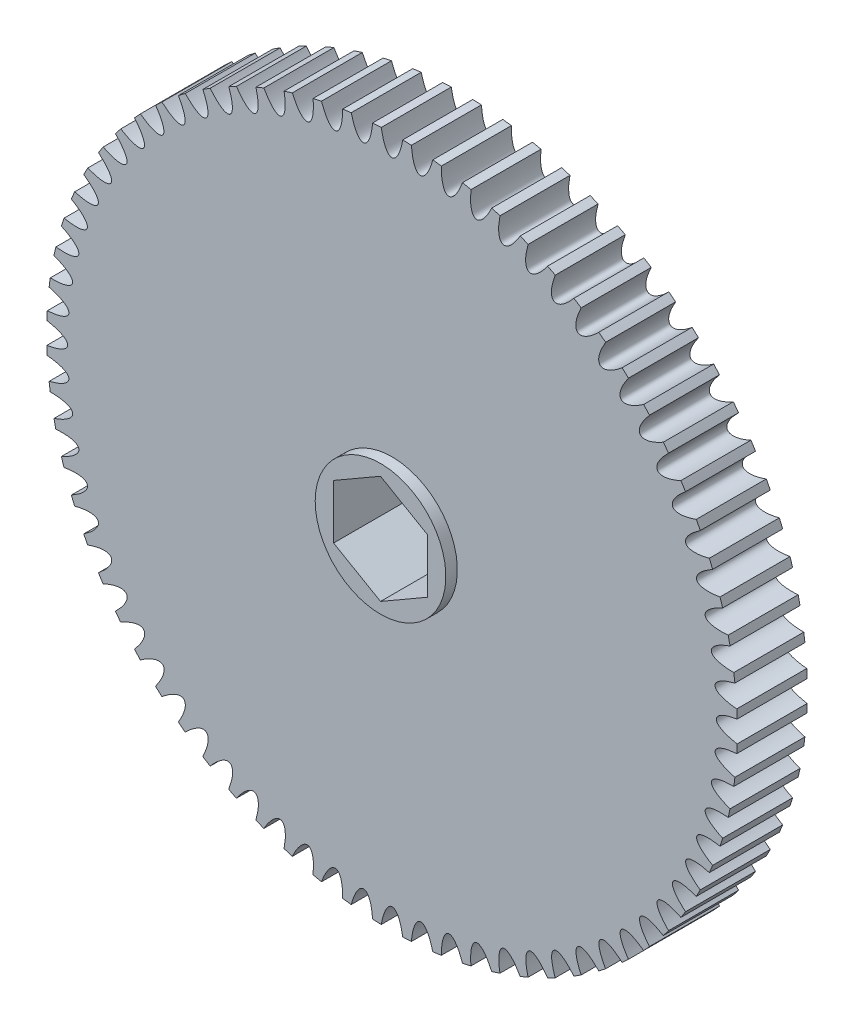
from build123d import *

# Parameters (mm, degrees)
BOSS_EXTRUDE1_DEPTH = 9.525
SKETCH2_R           = 8.89
BOSS_EXTRUDE2_DEPTH = 1.5621
BOSS_EXTRUDE3_START = 1.5621
SKETCH3_R           = 8.89
BOSS_EXTRUDE3_DEPTH = 1.5621
CUT_EXTRUDE1_DEPTH  = 68.615408008


with BuildPart() as part:
    # Sketch1 → Boss-Extrude1 (new body)
    with BuildSketch(Plane(origin=(0, 0, -4.7625), x_dir=(-1, 0, 0), z_dir=(0, 0, -1))):
        with BuildLine():
            ThreePointArc((-46.91598824, 2.63631324), (-46.945275932, 2.049675012), (-46.967228579, 1.462716529))
            add(Edge.make_bspline(
                [(-46.967228579, -1.462716529), (-38.209901537, 0.069174931), (-46.967228579, 1.462716529)],
                knots=[2.067305038, 2.067305038, 2.067305038, 4.210539871, 4.210539871, 4.210539871], degree=2, weights=[1, 0.478704803, 1]))
            ThreePointArc((-46.967228579, -1.462716529), (-46.945275932, -2.049675012), (-46.91598824, -2.63631324))
            add(Edge.make_bspline(
                [(-46.661019949, -5.550614143), (-38.070530317, -3.261300649), (-46.91598824, -2.63631324)],
                knots=[2.067305038, 2.067305038, 2.067305038, 4.210539871, 4.210539871, 4.210539871], degree=2, weights=[1, 0.478704803, 1]))
            ThreePointArc((-46.661019949, -5.550614143), (-46.587994036, -6.133425772), (-46.507688901, -6.715279074))
            add(Edge.make_bspline(
                [(-45.999692782, -9.596268231), (-37.641419376, -6.566955762), (-46.507688901, -6.715279074)],
                knots=[2.067305038, 2.067305038, 2.067305038, 4.210539871, 4.210539871, 4.210539871], degree=2, weights=[1, 0.478704803, 1]))
            ThreePointArc((-45.999692782, -9.596268231), (-45.876149375, -10.170497459), (-45.745437969, -10.743137579))
            add(Edge.make_bspline(
                [(-44.988280178, -13.568888924), (-36.925834504, -9.822632377), (-45.745437969, -10.743137579)],
                knots=[2.067305038, 2.067305038, 2.067305038, 4.210539871, 4.210539871, 4.210539871], degree=2, weights=[1, 0.478704803, 1]))
            ThreePointArc((-44.988280178, -13.568888924), (-44.815159516, -14.130165519), (-44.635036631, -14.689234321))
            add(Edge.make_bspline(
                [(-43.634479597, -17.438242179), (-35.929221735, -13.003552828), (-44.635036631, -14.689234321)],
                knots=[2.067305038, 2.067305038, 2.067305038, 4.210539871, 4.210539871, 4.210539871], degree=2, weights=[1, 0.478704803, 1]))
            ThreePointArc((-43.634479597, -17.438242179), (-43.413099233, -17.982294487), (-43.184935713, -18.52353712))
            add(Edge.make_bspline(
                [(-41.948594279, -21.174879882), (-34.659165893, -16.08550839), (-43.184935713, -18.52353712)],
                knots=[2.067305038, 2.067305038, 2.067305038, 4.210539871, 4.210539871, 4.210539871], degree=2, weights=[1, 0.478704803, 1]))
            ThreePointArc((-41.948594279, -21.174879882), (-41.680639051, -21.697567336), (-41.406171359, -22.216864616))
            add(Edge.make_bspline(
                [(-39.94345483, -24.750363962), (-33.125332872, -19.045043521), (-41.406171359, -22.216864616)],
                knots=[2.067305038, 2.067305038, 2.067305038, 4.210539871, 4.210539871, 4.210539871], degree=2, weights=[1, 0.478704803, 1]))
            ThreePointArc((-39.94345483, -24.750363962), (-39.630964039, -25.247708596), (-39.312281039, -25.741108358))
            add(Edge.make_bspline(
                [(-37.63432157, -28.137482829), (-31.339396067, -21.859634371), (-39.312281039, -25.741108358)],
                knots=[2.067305038, 2.067305038, 2.067305038, 4.210539871, 4.210539871, 4.210539871], degree=2, weights=[1, 0.478704803, 1]))
            ThreePointArc((-37.63432157, -28.137482829), (-37.27967346, -28.605699549), (-36.919200523, -29.069446722))
            add(Edge.make_bspline(
                [(-35.0387684, -31.310458461), (-29.314947533, -24.507860203), (-36.919200523, -29.069446722)],
                knots=[2.067305038, 2.067305038, 2.067305038, 4.210539871, 4.210539871, 4.210539871], degree=2, weights=[1, 0.478704803, 1]))
            ThreePointArc((-35.0387684, -31.310458461), (-34.644662057, -31.745983856), (-34.245142598, -32.176549045))
            add(Edge.make_bspline(
                [(-32.176549045, -34.245142598), (-27.067394547, -26.969566421), (-34.245142598, -32.176549045)],
                knots=[5.208897692, 5.208897692, 5.208897692, 7.352132525, 7.352132525, 7.352132525], degree=2, weights=[1, 0.478704803, 1]))
            ThreePointArc((-32.176549045, -34.245142598), (-31.745983856, -34.644662057), (-31.310458461, -35.0387684))
            add(Edge.make_bspline(
                [(-29.069446722, -36.919200523), (-24.613842347, -29.226017956), (-31.310458461, -35.0387684)],
                knots=[2.067305038, 2.067305038, 2.067305038, 4.210539871, 4.210539871, 4.210539871], degree=2, weights=[1, 0.478704803, 1]))
            ThreePointArc((-29.069446722, -36.919200523), (-28.605699549, -37.27967346), (-28.137482829, -37.63432157))
            add(Edge.make_bspline(
                [(-25.741108358, -39.312281039), (-21.972963943, -31.260041845), (-28.137482829, -37.63432157)],
                knots=[2.067305038, 2.067305038, 2.067305038, 4.210539871, 4.210539871, 4.210539871], degree=2, weights=[1, 0.478704803, 1]))
            ThreePointArc((-25.741108358, -39.312281039), (-25.247708596, -39.630964039), (-24.750363962, -39.94345483))
            add(Edge.make_bspline(
                [(-22.216864616, -41.406171359), (-19.164858016, -33.056157941), (-24.750363962, -39.94345483)],
                knots=[5.208897692, 5.208897692, 5.208897692, 7.352132525, 7.352132525, 7.352132525], degree=2, weights=[1, 0.478704803, 1]))
            ThreePointArc((-22.216864616, -41.406171359), (-21.697567336, -41.680639051), (-21.174879882, -41.948594279))
            add(Edge.make_bspline(
                [(-18.52353712, -43.184935713), (-16.210895948, -34.600696716), (-21.174879882, -41.948594279)],
                knots=[5.208897692, 5.208897692, 5.208897692, 7.352132524, 7.352132524, 7.352132524], degree=2, weights=[1, 0.478704803, 1]))
            ThreePointArc((-18.52353712, -43.184935713), (-17.982294487, -43.413099233), (-17.438242179, -43.634479597))
            add(Edge.make_bspline(
                [(-14.689234321, -44.635036631), (-13.133559172, -35.881903296), (-17.438242179, -43.634479597)],
                knots=[5.208897692, 5.208897692, 5.208897692, 7.352132524, 7.352132524, 7.352132524], degree=2, weights=[1, 0.478704803, 1]))
            ThreePointArc((-14.689234321, -44.635036631), (-14.130165519, -44.815159516), (-13.568888924, -44.988280178))
            add(Edge.make_bspline(
                [(-10.743137579, -45.745437969), (-9.956268082, -36.890026925), (-13.568888924, -44.988280178)],
                knots=[5.208897692, 5.208897692, 5.208897692, 7.352132524, 7.352132524, 7.352132524], degree=2, weights=[1, 0.478704803, 1]))
            ThreePointArc((-10.743137579, -45.745437969), (-10.170497459, -45.876149375), (-9.596268231, -45.999692782))
            add(Edge.make_bspline(
                [(-6.715279074, -46.507688901), (-6.703203779, -37.617395174), (-9.596268231, -45.999692782)],
                knots=[5.208897692, 5.208897692, 5.208897692, 7.352132524, 7.352132524, 7.352132524], degree=2, weights=[1, 0.478704803, 1]))
            ThreePointArc((-6.715279074, -46.507688901), (-6.133425772, -46.587994036), (-5.550614143, -46.661019949))
            add(Edge.make_bspline(
                [(-2.63631324, -46.91598824), (-3.399124048, -38.058472334), (-5.550614143, -46.661019949)],
                knots=[5.208897692, 5.208897692, 5.208897692, 7.352132524, 7.352132524, 7.352132524], degree=2, weights=[1, 0.478704803, 1]))
            ThreePointArc((-2.63631324, -46.91598824), (-2.049675012, -46.945275932), (-1.462716529, -46.967228579))
            add(Edge.make_bspline(
                [(1.462716529, -46.967228579), (-0.069174931, -38.209901537), (-1.462716529, -46.967228579)],
                knots=[5.208897692, 5.208897692, 5.208897692, 7.352132524, 7.352132524, 7.352132524], degree=2, weights=[1, 0.478704803, 1]))
            ThreePointArc((1.462716529, -46.967228579), (2.049675012, -46.945275932), (2.63631324, -46.91598824))
            add(Edge.make_bspline(
                [(5.550614143, -46.661019949), (3.261300649, -38.070530317), (2.63631324, -46.91598824)],
                knots=[5.208897692, 5.208897692, 5.208897692, 7.352132525, 7.352132525, 7.352132525], degree=2, weights=[1, 0.478704803, 1]))
            ThreePointArc((5.550614143, -46.661019949), (6.133425772, -46.587994036), (6.715279074, -46.507688901))
            add(Edge.make_bspline(
                [(9.596268231, -45.999692782), (6.566955762, -37.641419376), (6.715279074, -46.507688901)],
                knots=[2.067305038, 2.067305038, 2.067305038, 4.210539871, 4.210539871, 4.210539871], degree=2, weights=[1, 0.478704803, 1]))
            ThreePointArc((9.596268231, -45.999692782), (10.170497459, -45.876149375), (10.743137579, -45.745437969))
            add(Edge.make_bspline(
                [(13.568888924, -44.988280178), (9.822632377, -36.925834504), (10.743137579, -45.745437969)],
                knots=[5.208897692, 5.208897692, 5.208897692, 7.352132525, 7.352132525, 7.352132525], degree=2, weights=[1, 0.478704803, 1]))
            ThreePointArc((13.568888924, -44.988280178), (14.130165519, -44.815159516), (14.689234321, -44.635036631))
            add(Edge.make_bspline(
                [(17.438242179, -43.634479597), (13.003552828, -35.929221735), (14.689234321, -44.635036631)],
                knots=[5.208897692, 5.208897692, 5.208897692, 7.352132524, 7.352132524, 7.352132524], degree=2, weights=[1, 0.478704803, 1]))
            ThreePointArc((17.438242179, -43.634479597), (17.982294487, -43.413099233), (18.52353712, -43.184935713))
            add(Edge.make_bspline(
                [(21.174879882, -41.948594279), (16.08550839, -34.659165894), (18.52353712, -43.184935713)],
                knots=[5.208897692, 5.208897692, 5.208897692, 7.352132525, 7.352132525, 7.352132525], degree=2, weights=[1, 0.478704803, 1]))
            ThreePointArc((21.174879882, -41.948594279), (21.697567336, -41.680639051), (22.216864616, -41.406171359))
            add(Edge.make_bspline(
                [(24.750363962, -39.94345483), (19.045043521, -33.125332873), (22.216864616, -41.406171359)],
                knots=[5.208897692, 5.208897692, 5.208897692, 7.352132524, 7.352132524, 7.352132524], degree=2, weights=[1, 0.478704803, 1]))
            ThreePointArc((24.750363962, -39.94345483), (25.247708596, -39.630964039), (25.741108358, -39.312281039))
            add(Edge.make_bspline(
                [(28.137482829, -37.63432157), (21.85963437, -31.339396066), (25.741108358, -39.312281039)],
                knots=[5.208897692, 5.208897692, 5.208897692, 7.352132525, 7.352132525, 7.352132525], degree=2, weights=[1, 0.478704803, 1]))
            ThreePointArc((28.137482829, -37.63432157), (28.605699549, -37.27967346), (29.069446722, -36.919200523))
            add(Edge.make_bspline(
                [(31.310458461, -35.0387684), (24.507860204, -29.314947533), (29.069446722, -36.919200523)],
                knots=[5.208897692, 5.208897692, 5.208897692, 7.352132524, 7.352132524, 7.352132524], degree=2, weights=[1, 0.478704803, 1]))
            ThreePointArc((31.310458461, -35.0387684), (31.745983856, -34.644662057), (32.176549045, -34.245142598))
            add(Edge.make_bspline(
                [(34.245142598, -32.176549045), (26.969566423, -27.067394549), (32.176549045, -34.245142598)],
                knots=[5.208897692, 5.208897692, 5.208897692, 7.352132524, 7.352132524, 7.352132524], degree=2, weights=[1, 0.478704803, 1]))
            ThreePointArc((34.245142598, -32.176549045), (34.644662057, -31.745983856), (35.0387684, -31.310458461))
            add(Edge.make_bspline(
                [(36.919200523, -29.069446722), (29.226017957, -24.613842347), (35.0387684, -31.310458461)],
                knots=[5.208897692, 5.208897692, 5.208897692, 7.352132524, 7.352132524, 7.352132524], degree=2, weights=[1, 0.478704803, 1]))
            ThreePointArc((36.919200523, -29.069446722), (37.27967346, -28.605699549), (37.63432157, -28.137482829))
            add(Edge.make_bspline(
                [(39.312281039, -25.741108358), (31.260041845, -21.972963943), (37.63432157, -28.137482829)],
                knots=[5.208897692, 5.208897692, 5.208897692, 7.352132525, 7.352132525, 7.352132525], degree=2, weights=[1, 0.478704803, 1]))
            ThreePointArc((39.312281039, -25.741108358), (39.630964039, -25.247708596), (39.94345483, -24.750363962))
            add(Edge.make_bspline(
                [(41.406171359, -22.216864616), (33.056157942, -19.164858016), (39.94345483, -24.750363962)],
                knots=[5.208897692, 5.208897692, 5.208897692, 7.352132524, 7.352132524, 7.352132524], degree=2, weights=[1, 0.478704803, 1]))
            ThreePointArc((41.406171359, -22.216864616), (41.680639051, -21.697567336), (41.948594279, -21.174879882))
            add(Edge.make_bspline(
                [(43.184935713, -18.52353712), (34.600696716, -16.210895948), (41.948594279, -21.174879882)],
                knots=[5.208897692, 5.208897692, 5.208897692, 7.352132524, 7.352132524, 7.352132524], degree=2, weights=[1, 0.478704803, 1]))
            ThreePointArc((43.184935713, -18.52353712), (43.413099233, -17.982294487), (43.634479597, -17.438242179))
            add(Edge.make_bspline(
                [(44.635036631, -14.689234321), (35.881903295, -13.133559172), (43.634479597, -17.438242179)],
                knots=[5.208897692, 5.208897692, 5.208897692, 7.352132524, 7.352132524, 7.352132524], degree=2, weights=[1, 0.478704803, 1]))
            ThreePointArc((44.635036631, -14.689234321), (44.815159516, -14.130165519), (44.988280178, -13.568888924))
            add(Edge.make_bspline(
                [(45.745437969, -10.743137579), (36.890026925, -9.956268082), (44.988280178, -13.568888924)],
                knots=[5.208897692, 5.208897692, 5.208897692, 7.352132524, 7.352132524, 7.352132524], degree=2, weights=[1, 0.478704803, 1]))
            ThreePointArc((45.745437969, -10.743137579), (45.876149375, -10.170497459), (45.999692782, -9.596268231))
            add(Edge.make_bspline(
                [(46.507688901, -6.715279074), (37.617395175, -6.703203779), (45.999692782, -9.596268231)],
                knots=[5.208897692, 5.208897692, 5.208897692, 7.352132524, 7.352132524, 7.352132524], degree=2, weights=[1, 0.478704803, 1]))
            ThreePointArc((46.507688901, -6.715279074), (46.587994036, -6.133425772), (46.661019949, -5.550614143))
            add(Edge.make_bspline(
                [(46.91598824, -2.63631324), (38.058472333, -3.399124048), (46.661019949, -5.550614143)],
                knots=[5.208897692, 5.208897692, 5.208897692, 7.352132524, 7.352132524, 7.352132524], degree=2, weights=[1, 0.478704803, 1]))
            ThreePointArc((46.91598824, -2.63631324), (46.945275932, -2.049675012), (46.967228579, -1.462716529))
            add(Edge.make_bspline(
                [(46.967228579, 1.462716529), (38.209901537, -0.069174931), (46.967228579, -1.462716529)],
                knots=[5.208897692, 5.208897692, 5.208897692, 7.352132524, 7.352132524, 7.352132524], degree=2, weights=[1, 0.478704803, 1]))
            ThreePointArc((46.967228579, 1.462716529), (46.945275932, 2.049675012), (46.91598824, 2.63631324))
            add(Edge.make_bspline(
                [(46.661019949, 5.550614143), (38.070530318, 3.261300649), (46.91598824, 2.63631324)],
                knots=[5.208897692, 5.208897692, 5.208897692, 7.352132524, 7.352132524, 7.352132524], degree=2, weights=[1, 0.478704803, 1]))
            ThreePointArc((46.661019949, 5.550614143), (46.587994036, 6.133425772), (46.507688901, 6.715279074))
            add(Edge.make_bspline(
                [(45.999692782, 9.596268231), (37.641419376, 6.566955762), (46.507688901, 6.715279074)],
                knots=[5.208897692, 5.208897692, 5.208897692, 7.352132524, 7.352132524, 7.352132524], degree=2, weights=[1, 0.478704803, 1]))
            ThreePointArc((45.999692782, 9.596268231), (45.876149375, 10.170497459), (45.745437969, 10.743137579))
            add(Edge.make_bspline(
                [(44.988280178, 13.568888924), (36.925834504, 9.822632377), (45.745437969, 10.743137579)],
                knots=[5.208897692, 5.208897692, 5.208897692, 7.352132524, 7.352132524, 7.352132524], degree=2, weights=[1, 0.478704803, 1]))
            ThreePointArc((44.988280178, 13.568888924), (44.815159516, 14.130165519), (44.635036631, 14.689234321))
            add(Edge.make_bspline(
                [(43.634479597, 17.438242179), (35.929221736, 13.003552828), (44.635036631, 14.689234321)],
                knots=[5.208897692, 5.208897692, 5.208897692, 7.352132524, 7.352132524, 7.352132524], degree=2, weights=[1, 0.478704803, 1]))
            ThreePointArc((43.634479597, 17.438242179), (43.413099233, 17.982294487), (43.184935713, 18.52353712))
            add(Edge.make_bspline(
                [(41.948594279, 21.174879882), (34.659165894, 16.08550839), (43.184935713, 18.52353712)],
                knots=[5.208897692, 5.208897692, 5.208897692, 7.352132525, 7.352132525, 7.352132525], degree=2, weights=[1, 0.478704803, 1]))
            ThreePointArc((41.948594279, 21.174879882), (41.680639051, 21.697567336), (41.406171359, 22.216864616))
            add(Edge.make_bspline(
                [(39.94345483, 24.750363962), (33.125332873, 19.045043521), (41.406171359, 22.216864616)],
                knots=[5.208897692, 5.208897692, 5.208897692, 7.352132524, 7.352132524, 7.352132524], degree=2, weights=[1, 0.478704803, 1]))
            ThreePointArc((39.94345483, 24.750363962), (39.630964039, 25.247708596), (39.312281039, 25.741108358))
            add(Edge.make_bspline(
                [(37.63432157, 28.137482829), (31.339396067, 21.859634371), (39.312281039, 25.741108358)],
                knots=[5.208897692, 5.208897692, 5.208897692, 7.352132524, 7.352132524, 7.352132524], degree=2, weights=[1, 0.478704803, 1]))
            ThreePointArc((37.63432157, 28.137482829), (37.27967346, 28.605699549), (36.919200523, 29.069446722))
            add(Edge.make_bspline(
                [(35.0387684, 31.310458461), (29.314947533, 24.507860203), (36.919200523, 29.069446722)],
                knots=[5.208897692, 5.208897692, 5.208897692, 7.352132525, 7.352132525, 7.352132525], degree=2, weights=[1, 0.478704803, 1]))
            ThreePointArc((35.0387684, 31.310458461), (34.644662057, 31.745983856), (34.245142598, 32.176549045))
            add(Edge.make_bspline(
                [(32.176549045, 34.245142598), (27.067394549, 26.969566423), (34.245142598, 32.176549045)],
                knots=[2.067305039, 2.067305039, 2.067305039, 4.210539871, 4.210539871, 4.210539871], degree=2, weights=[1, 0.478704803, 1]))
            ThreePointArc((32.176549045, 34.245142598), (31.745983856, 34.644662057), (31.310458461, 35.0387684))
            add(Edge.make_bspline(
                [(29.069446722, 36.919200523), (24.613842347, 29.226017957), (31.310458461, 35.0387684)],
                knots=[2.067305039, 2.067305039, 2.067305039, 4.210539871, 4.210539871, 4.210539871], degree=2, weights=[1, 0.478704803, 1]))
            ThreePointArc((29.069446722, 36.919200523), (28.605699549, 37.27967346), (28.137482829, 37.63432157))
            add(Edge.make_bspline(
                [(25.741108358, 39.312281039), (21.972963943, 31.260041845), (28.137482829, 37.63432157)],
                knots=[2.067305038, 2.067305038, 2.067305038, 4.210539871, 4.210539871, 4.210539871], degree=2, weights=[1, 0.478704803, 1]))
            ThreePointArc((25.741108358, 39.312281039), (25.247708596, 39.630964039), (24.750363962, 39.94345483))
            add(Edge.make_bspline(
                [(22.216864616, 41.406171359), (19.164858016, 33.056157942), (24.750363962, 39.94345483)],
                knots=[2.067305039, 2.067305039, 2.067305039, 4.210539871, 4.210539871, 4.210539871], degree=2, weights=[1, 0.478704803, 1]))
            ThreePointArc((22.216864616, 41.406171359), (21.697567336, 41.680639051), (21.174879882, 41.948594279))
            add(Edge.make_bspline(
                [(18.52353712, 43.184935713), (16.210895948, 34.600696717), (21.174879882, 41.948594279)],
                knots=[2.067305039, 2.067305039, 2.067305039, 4.210539871, 4.210539871, 4.210539871], degree=2, weights=[1, 0.478704803, 1]))
            ThreePointArc((18.52353712, 43.184935713), (17.982294487, 43.413099233), (17.438242179, 43.634479597))
            add(Edge.make_bspline(
                [(14.689234321, 44.635036631), (13.133559172, 35.881903295), (17.438242179, 43.634479597)],
                knots=[2.067305038, 2.067305038, 2.067305038, 4.210539871, 4.210539871, 4.210539871], degree=2, weights=[1, 0.478704803, 1]))
            ThreePointArc((14.689234321, 44.635036631), (14.130165519, 44.815159516), (13.568888924, 44.988280178))
            add(Edge.make_bspline(
                [(10.743137579, 45.745437969), (9.956268082, 36.890026925), (13.568888924, 44.988280178)],
                knots=[2.067305038, 2.067305038, 2.067305038, 4.210539871, 4.210539871, 4.210539871], degree=2, weights=[1, 0.478704803, 1]))
            ThreePointArc((10.743137579, 45.745437969), (10.170497459, 45.876149375), (9.596268231, 45.999692782))
            add(Edge.make_bspline(
                [(6.715279074, 46.507688901), (6.703203779, 37.617395175), (9.596268231, 45.999692782)],
                knots=[2.067305038, 2.067305038, 2.067305038, 4.210539871, 4.210539871, 4.210539871], degree=2, weights=[1, 0.478704803, 1]))
            ThreePointArc((6.715279074, 46.507688901), (6.133425772, 46.587994036), (5.550614143, 46.661019949))
            add(Edge.make_bspline(
                [(2.63631324, 46.91598824), (3.399124048, 38.058472334), (5.550614143, 46.661019949)],
                knots=[2.067305038, 2.067305038, 2.067305038, 4.210539871, 4.210539871, 4.210539871], degree=2, weights=[1, 0.478704803, 1]))
            ThreePointArc((2.63631324, 46.91598824), (2.049675012, 46.945275932), (1.462716529, 46.967228579))
            add(Edge.make_bspline(
                [(-1.462716529, 46.967228579), (0.069174931, 38.209901537), (1.462716529, 46.967228579)],
                knots=[2.067305038, 2.067305038, 2.067305038, 4.210539871, 4.210539871, 4.210539871], degree=2, weights=[1, 0.478704803, 1]))
            ThreePointArc((-1.462716529, 46.967228579), (-2.049675012, 46.945275932), (-2.63631324, 46.91598824))
            add(Edge.make_bspline(
                [(-5.550614143, 46.661019949), (-3.261300649, 38.070530318), (-2.63631324, 46.91598824)],
                knots=[2.067305038, 2.067305038, 2.067305038, 4.210539871, 4.210539871, 4.210539871], degree=2, weights=[1, 0.478704803, 1]))
            ThreePointArc((-5.550614143, 46.661019949), (-6.133425772, 46.587994036), (-6.715279074, 46.507688901))
            add(Edge.make_bspline(
                [(-9.596268231, 45.999692782), (-6.566955763, 37.641419377), (-6.715279074, 46.507688901)],
                knots=[2.067305039, 2.067305039, 2.067305039, 4.210539871, 4.210539871, 4.210539871], degree=2, weights=[1, 0.478704803, 1]))
            ThreePointArc((-9.596268231, 45.999692782), (-10.170497459, 45.876149375), (-10.743137579, 45.745437969))
            add(Edge.make_bspline(
                [(-13.568888924, 44.988280178), (-9.822632377, 36.925834505), (-10.743137579, 45.745437969)],
                knots=[2.067305039, 2.067305039, 2.067305039, 4.210539871, 4.210539871, 4.210539871], degree=2, weights=[1, 0.478704803, 1]))
            ThreePointArc((-13.568888924, 44.988280178), (-14.130165519, 44.815159516), (-14.689234321, 44.635036631))
            add(Edge.make_bspline(
                [(-17.438242179, 43.634479597), (-13.003552828, 35.929221736), (-14.689234321, 44.635036631)],
                knots=[2.067305039, 2.067305039, 2.067305039, 4.210539871, 4.210539871, 4.210539871], degree=2, weights=[1, 0.478704803, 1]))
            ThreePointArc((-17.438242179, 43.634479597), (-17.982294487, 43.413099233), (-18.52353712, 43.184935713))
            add(Edge.make_bspline(
                [(-21.174879882, 41.948594279), (-16.085508391, 34.659165895), (-18.52353712, 43.184935713)],
                knots=[2.067305039, 2.067305039, 2.067305039, 4.210539871, 4.210539871, 4.210539871], degree=2, weights=[1, 0.478704803, 1]))
            ThreePointArc((-21.174879882, 41.948594279), (-21.697567336, 41.680639051), (-22.216864616, 41.406171359))
            add(Edge.make_bspline(
                [(-24.750363962, 39.94345483), (-19.04504352, 33.125332872), (-22.216864616, 41.406171359)],
                knots=[2.067305038, 2.067305038, 2.067305038, 4.210539871, 4.210539871, 4.210539871], degree=2, weights=[1, 0.478704803, 1]))
            ThreePointArc((-24.750363962, 39.94345483), (-25.247708596, 39.630964039), (-25.741108358, 39.312281039))
            add(Edge.make_bspline(
                [(-28.137482829, 37.63432157), (-21.859634371, 31.339396067), (-25.741108358, 39.312281039)],
                knots=[2.067305038, 2.067305038, 2.067305038, 4.210539871, 4.210539871, 4.210539871], degree=2, weights=[1, 0.478704803, 1]))
            ThreePointArc((-28.137482829, 37.63432157), (-28.605699549, 37.27967346), (-29.069446722, 36.919200523))
            add(Edge.make_bspline(
                [(-31.310458461, 35.0387684), (-24.507860204, 29.314947533), (-29.069446722, 36.919200523)],
                knots=[2.067305038, 2.067305038, 2.067305038, 4.210539871, 4.210539871, 4.210539871], degree=2, weights=[1, 0.478704803, 1]))
            ThreePointArc((-31.310458461, 35.0387684), (-31.745983856, 34.644662057), (-32.176549045, 34.245142598))
            add(Edge.make_bspline(
                [(-34.245142598, 32.176549045), (-26.969566422, 27.067394548), (-32.176549045, 34.245142598)],
                knots=[2.067305038, 2.067305038, 2.067305038, 4.210539871, 4.210539871, 4.210539871], degree=2, weights=[1, 0.478704803, 1]))
            ThreePointArc((-34.245142598, 32.176549045), (-34.644662057, 31.745983856), (-35.0387684, 31.310458461))
            add(Edge.make_bspline(
                [(-36.919200523, 29.069446722), (-29.226017957, 24.613842347), (-35.0387684, 31.310458461)],
                knots=[2.067305039, 2.067305039, 2.067305039, 4.210539871, 4.210539871, 4.210539871], degree=2, weights=[1, 0.478704803, 1]))
            ThreePointArc((-36.919200523, 29.069446722), (-37.27967346, 28.605699549), (-37.63432157, 28.137482829))
            add(Edge.make_bspline(
                [(-39.312281039, 25.741108358), (-31.260041845, 21.972963943), (-37.63432157, 28.137482829)],
                knots=[2.067305038, 2.067305038, 2.067305038, 4.210539871, 4.210539871, 4.210539871], degree=2, weights=[1, 0.478704803, 1]))
            ThreePointArc((-39.312281039, 25.741108358), (-39.630964039, 25.247708596), (-39.94345483, 24.750363962))
            add(Edge.make_bspline(
                [(-41.406171359, 22.216864616), (-33.056157942, 19.164858016), (-39.94345483, 24.750363962)],
                knots=[2.067305039, 2.067305039, 2.067305039, 4.210539871, 4.210539871, 4.210539871], degree=2, weights=[1, 0.478704803, 1]))
            ThreePointArc((-41.406171359, 22.216864616), (-41.680639051, 21.697567336), (-41.948594279, 21.174879882))
            add(Edge.make_bspline(
                [(-43.184935713, 18.52353712), (-34.600696716, 16.210895948), (-41.948594279, 21.174879882)],
                knots=[2.067305038, 2.067305038, 2.067305038, 4.210539871, 4.210539871, 4.210539871], degree=2, weights=[1, 0.478704803, 1]))
            ThreePointArc((-43.184935713, 18.52353712), (-43.413099233, 17.982294487), (-43.634479597, 17.438242179))
            add(Edge.make_bspline(
                [(-44.635036631, 14.689234321), (-35.881903295, 13.133559172), (-43.634479597, 17.438242179)],
                knots=[2.067305038, 2.067305038, 2.067305038, 4.210539871, 4.210539871, 4.210539871], degree=2, weights=[1, 0.478704803, 1]))
            ThreePointArc((-44.635036631, 14.689234321), (-44.815159516, 14.130165519), (-44.988280178, 13.568888924))
            add(Edge.make_bspline(
                [(-45.745437969, 10.743137579), (-36.890026925, 9.956268082), (-44.988280178, 13.568888924)],
                knots=[2.067305038, 2.067305038, 2.067305038, 4.210539871, 4.210539871, 4.210539871], degree=2, weights=[1, 0.478704803, 1]))
            ThreePointArc((-45.745437969, 10.743137579), (-45.876149375, 10.170497459), (-45.999692782, 9.596268231))
            add(Edge.make_bspline(
                [(-46.507688901, 6.715279074), (-37.617395174, 6.703203779), (-45.999692782, 9.596268231)],
                knots=[2.067305038, 2.067305038, 2.067305038, 4.210539871, 4.210539871, 4.210539871], degree=2, weights=[1, 0.478704803, 1]))
            ThreePointArc((-46.507688901, 6.715279074), (-46.587994036, 6.133425772), (-46.661019949, 5.550614143))
            add(Edge.make_bspline(
                [(-46.91598824, 2.63631324), (-38.058472333, 3.399124048), (-46.661019949, 5.550614143)],
                knots=[2.067305038, 2.067305038, 2.067305038, 4.210539871, 4.210539871, 4.210539871], degree=2, weights=[1, 0.478704803, 1]))
        make_face()
    extrude(amount=-BOSS_EXTRUDE1_DEPTH)

    # Sketch2 → Boss-Extrude2 (add)
    with BuildSketch(Plane(origin=(0, 0, -4.7625), x_dir=(-1, 0, 0), z_dir=(0, 0, -1))):
        Circle(SKETCH2_R)
    extrude(amount=BOSS_EXTRUDE2_DEPTH)

    # Sketch3 → Boss-Extrude3 (add)
    with BuildSketch(Plane.XY.offset(4.7625).offset(BOSS_EXTRUDE3_START)):
        Circle(SKETCH3_R)
    extrude(amount=-BOSS_EXTRUDE3_DEPTH)

    # Sketch4 → Cut-Extrude1 (cut, through all)
    with BuildSketch(Plane.XY.offset(6.3246)):
        Polygon((6.3881, -3.688171255), (6.3881, 3.688171255), (0, 7.376342509), (-6.3881, 3.688171255), (-6.3881, -3.688171255), (0, -7.376342509), align=None)
    extrude(amount=-CUT_EXTRUDE1_DEPTH, mode=Mode.SUBTRACT)


solid = part.part
